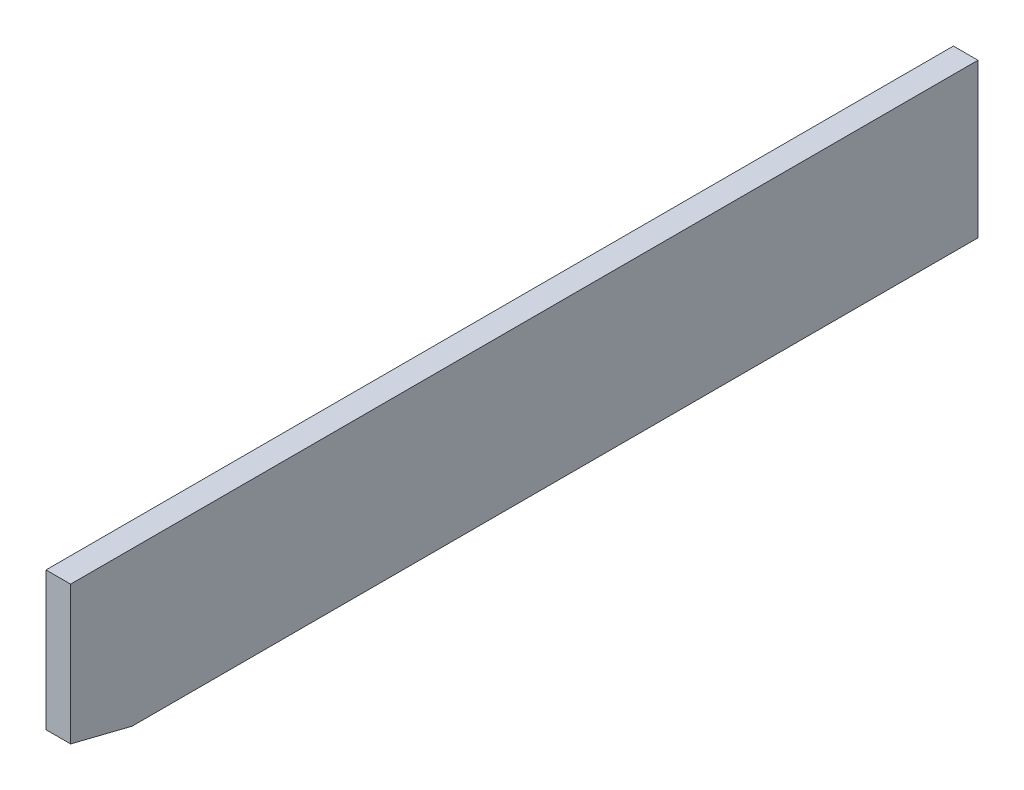
from build123d import *

# Parameters (mm, degrees)
BOSS_EXTRUDE1_DEPTH = 8


with BuildPart() as part:
    # Sketch1 → Boss-Extrude1 (new body)
    with BuildSketch(Plane(origin=(0, 0, 0), x_dir=(0, 0, -1), z_dir=(1, 0, 0))):
        Polygon((-147.5, -20), (-127.5, -25), (147.5, -25), (147.5, 25), (-147.5, 25), align=None)
    extrude(amount=BOSS_EXTRUDE1_DEPTH)


solid = part.part
